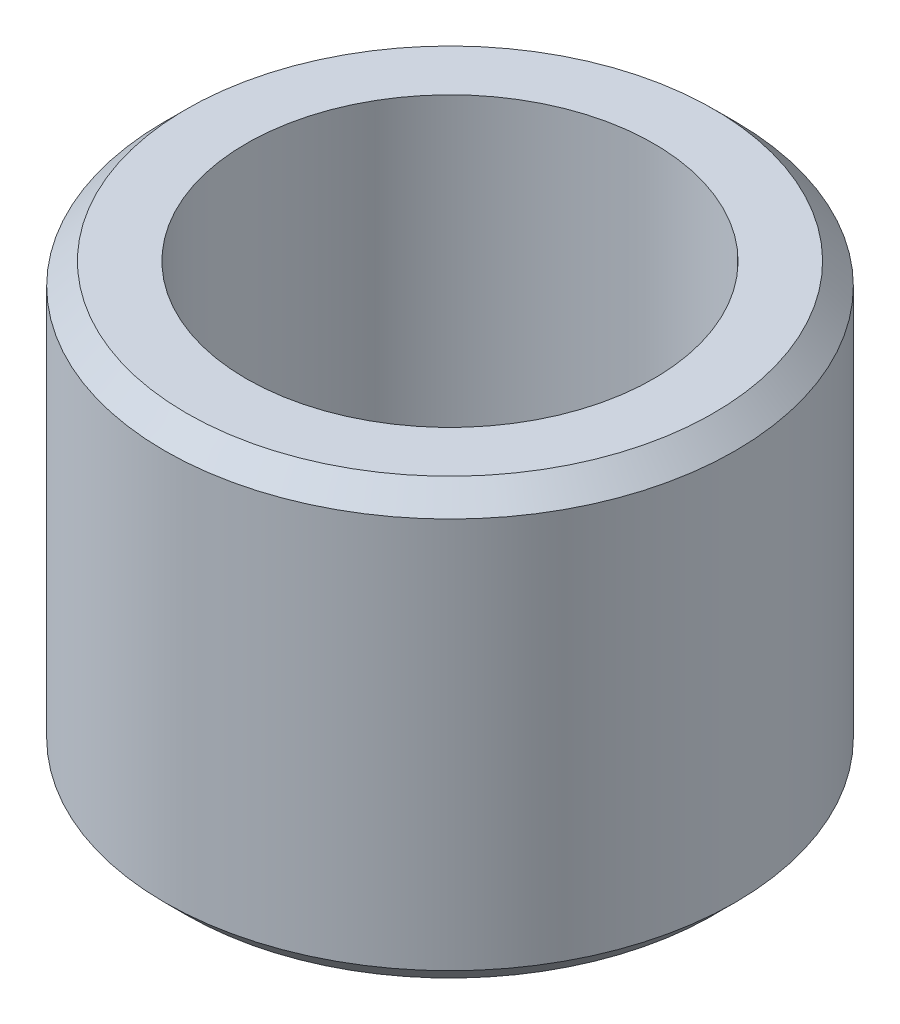
from build123d import *

# Parameters (mm, degrees)
SKETCH_1_R      = 10.5
SKETCH_1_R_2    = 7.5
EXTRUDE_1_DEPTH = 16
CHAMFER_1_SIZE  = 0.8


with BuildPart() as part:
    # 草图1 → 凸台-拉伸1 (new body)
    with BuildSketch(Plane(origin=(0, 0, 0), x_dir=(1, 0, 0), z_dir=(0, 1, 0))):
        with Locations(Location((0, 0, 0), (0, 0, 270))):
            Circle(SKETCH_1_R)
        with Locations(Location((0, 0, 0), (0, 0, 270))):
            Circle(SKETCH_1_R_2, mode=Mode.SUBTRACT)
    extrude(amount=EXTRUDE_1_DEPTH)

    # 倒角1
    chamfer_1_edges = [part.edges().sort_by_distance(p)[0] for p in [
        (0, 0, -10.5),
        (0, 16, -10.5),
    ]]
    chamfer(chamfer_1_edges, length=CHAMFER_1_SIZE)


solid = part.part
